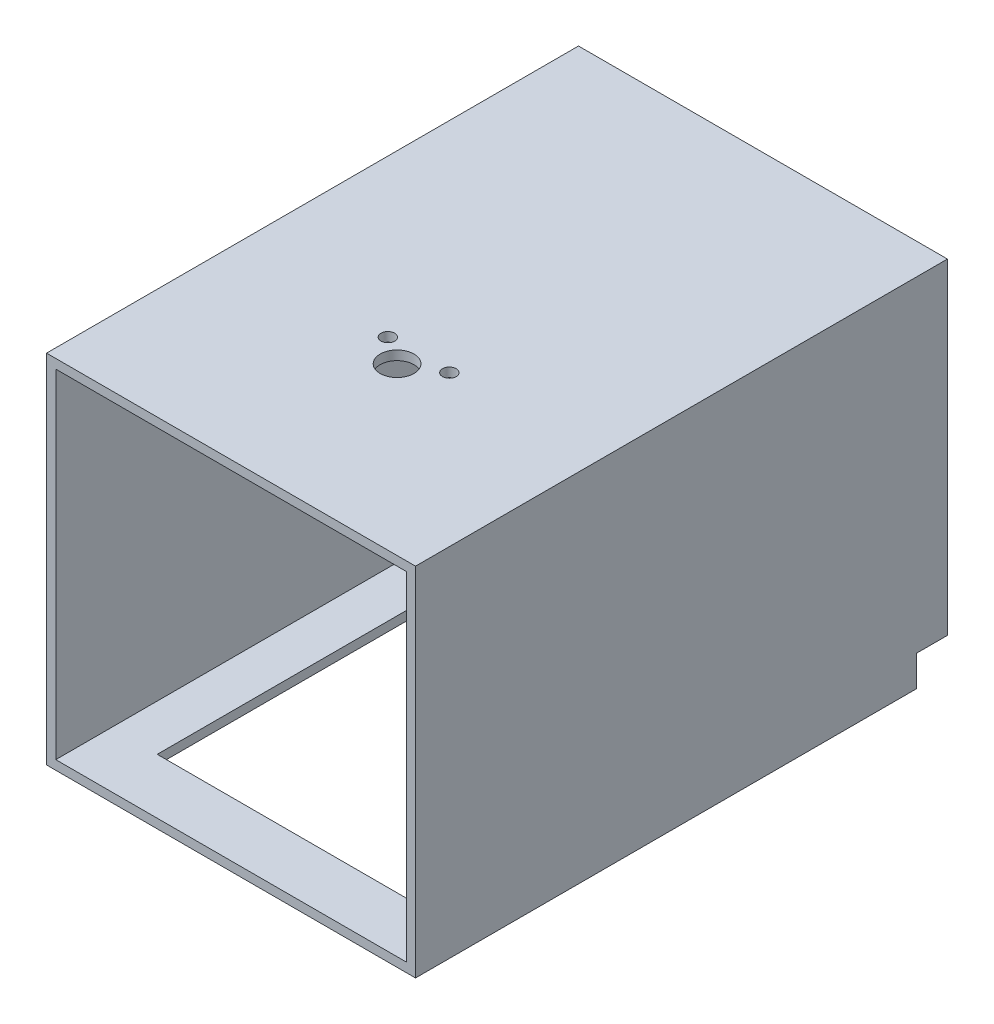
from build123d import *

# Parameters (mm, degrees)
SKETCH2_W           = 600
SKETCH2_H           = 530
SKETCH2_W_2         = 570
SKETCH2_H_2         = 500
BASE_EXTRUDE_DEPTH  = 50
SKETCH3_W           = 600
SKETCH3_H           = 580
BOSS_EXTRUDE2_DEPTH = 15
SKETCH4_W           = 600
SKETCH4_H           = 580
SKETCH4_W_2         = 570
SKETCH4_H_2         = 550
BOSS_EXTRUDE3_DEPTH = 800
CUT_EXTRUDE1_REACH  = 1203.926
SKETCH5_W           = 420
SKETCH5_H           = 635
SKETCH6_R           = 11.180339887
SKETCH6_R_2         = 27.5
CUT_EXTRUDE2_DEPTH  = 1195.759390003


with BuildPart() as part:
    # Sketch2 → Base-Extrude (new body)
    with BuildSketch(Plane.XY):
        with Locations((300, -265)):
            Rectangle(SKETCH2_W, SKETCH2_H)
        with Locations((300, -265)):
            Rectangle(SKETCH2_W_2, SKETCH2_H_2, mode=Mode.SUBTRACT)
    extrude(amount=BASE_EXTRUDE_DEPTH)

    # Sketch3 → Boss-Extrude2 (add)
    with BuildSketch(Plane.XY.offset(50)):
        with Locations((300, -290)):
            Rectangle(SKETCH3_W, SKETCH3_H)
    extrude(amount=BOSS_EXTRUDE2_DEPTH)

    # Sketch4 → Boss-Extrude3 (add)
    with BuildSketch(Plane.XY.offset(65)):
        with Locations((300, -290)):
            Rectangle(SKETCH4_W, SKETCH4_H)
        with Locations((300, -290)):
            Rectangle(SKETCH4_W_2, SKETCH4_H_2, mode=Mode.SUBTRACT)
    extrude(amount=BOSS_EXTRUDE3_DEPTH)

    # Sketch5 → Cut-Extrude1 (cut, up to next)
    with BuildSketch(Plane.XZ.offset(580), mode=Mode.PRIVATE) as cut_extrude1_sk1:
        with Locations((300, 457.5)):
            Rectangle(SKETCH5_W, SKETCH5_H)
    cut_extrude1_tool1 = extrude(cut_extrude1_sk1.sketch, amount=-CUT_EXTRUDE1_REACH, mode=Mode.PRIVATE) & part.part
    add(cut_extrude1_tool1.solids().sort_by_distance((300, -580, 457.5))[0], mode=Mode.SUBTRACT)

    # Sketch6 → Cut-Extrude2 (cut, through all)
    with BuildSketch(Plane.XZ.offset(15)):
        with Locations(Location((355, 565, 0), (0, 0, 270))):
            Circle(SKETCH6_R)
        with Locations(Location((255, 565, 0), (0, 0, 270))):
            Circle(SKETCH6_R)
        with Locations(Location((300, 595, 0), (0, 0, 270))):
            Circle(SKETCH6_R_2)
    extrude(amount=-CUT_EXTRUDE2_DEPTH, mode=Mode.SUBTRACT)


solid = part.part
